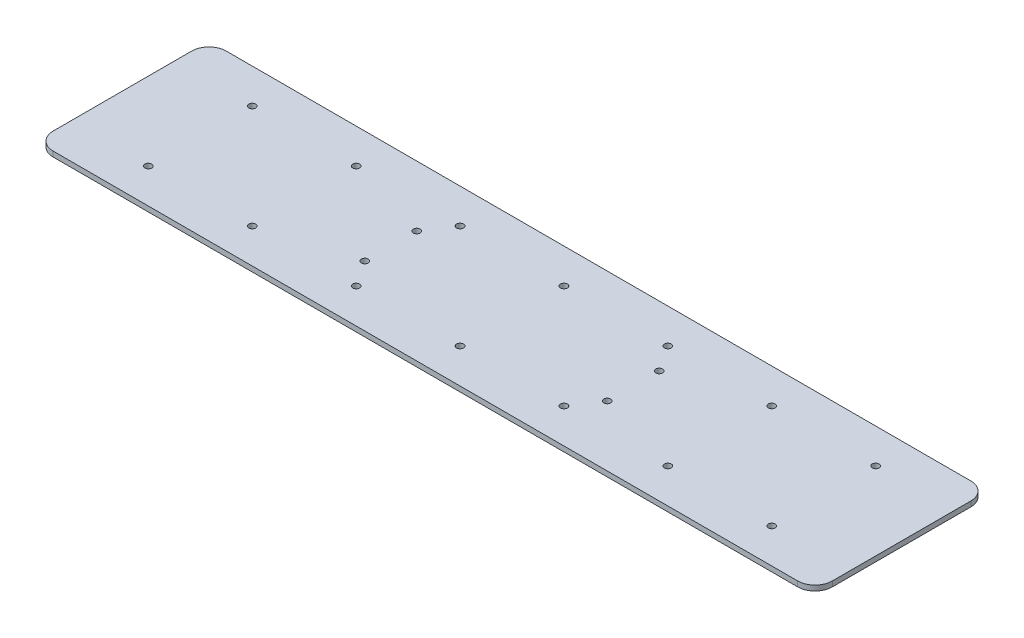
from build123d import *

# Parameters (mm, degrees)
EXTRUDE_1_DEPTH     = 3
SKETCH_2_R          = 2
CUT_EXTRUDE_1_DEPTH = 231.508134347
SKETCH_3_R          = 2
CUT_EXTRUDE_2_DEPTH = 231.508134347
SKETCH_4_R          = 2
CUT_EXTRUDE_3_DEPTH = 231.508134347


with BuildPart() as part:
    # 草图1 → 凸台-拉伸1 (new body)
    with BuildSketch(Plane(origin=(0, 0, 0), x_dir=(1, 0, 0), z_dir=(0, 1, 0))):
        with BuildLine():
            Line((-215, 50), (215, 50))
            ThreePointArc((215, 50), (222.071067812, 47.071067812), (225, 40))
            Line((225, 40), (225, -40))
            ThreePointArc((225, -40), (222.071067812, -47.071067812), (215, -50))
            Line((215, -50), (-215, -50))
            ThreePointArc((-215, -50), (-222.071067812, -47.071067812), (-225, -40))
            Line((-225, -40), (-225, 40))
            ThreePointArc((-225, 40), (-222.071067812, 47.071067812), (-215, 50))
        make_face()
    extrude(amount=EXTRUDE_1_DEPTH)

    # 草图2 → 切除-拉伸1 (cut, through all)
    with BuildSketch(Plane(origin=(0, 3, 0), x_dir=(1, 0, 0), z_dir=(0, 1, 0))):
        with Locations(Location((-180, -30, 0), (0, 0, 270))):
            Circle(SKETCH_2_R)
        with Locations(Location((-120, -30, 0), (0, 0, 270))):
            Circle(SKETCH_2_R)
        with Locations(Location((-60, -30, 0), (0, 0, 270))):
            Circle(SKETCH_2_R)
        with Locations(Location((0, -30, 0), (0, 0, 270))):
            Circle(SKETCH_2_R)
        with Locations(Location((60, -30, 0), (0, 0, 270))):
            Circle(SKETCH_2_R)
        with Locations(Location((120, -30, 0), (0, 0, 270))):
            Circle(SKETCH_2_R)
        with Locations(Location((180, -30, 0), (0, 0, 270))):
            Circle(SKETCH_2_R)
    extrude(amount=-CUT_EXTRUDE_1_DEPTH, mode=Mode.SUBTRACT)

    # 草图3 → 切除-拉伸2 (cut, through all)
    with BuildSketch(Plane(origin=(0, 3, 0), x_dir=(1, 0, 0), z_dir=(0, 1, 0))):
        with Locations(Location((-180, 30, 0), (0, 0, 270))):
            Circle(SKETCH_3_R)
        with Locations(Location((-120, 30, 0), (0, 0, 270))):
            Circle(SKETCH_3_R)
        with Locations(Location((-60, 30, 0), (0, 0, 270))):
            Circle(SKETCH_3_R)
        with Locations(Location((0, 30, 0), (0, 0, 270))):
            Circle(SKETCH_3_R)
        with Locations(Location((60, 30, 0), (0, 0, 270))):
            Circle(SKETCH_3_R)
        with Locations(Location((120, 30, 0), (0, 0, 270))):
            Circle(SKETCH_3_R)
        with Locations(Location((180, 30, 0), (0, 0, 270))):
            Circle(SKETCH_3_R)
    extrude(amount=-CUT_EXTRUDE_2_DEPTH, mode=Mode.SUBTRACT)

    # 草图4 → 切除-拉伸3 (cut, through all)
    with BuildSketch(Plane(origin=(0, 3, 0), x_dir=(1, 0, 0), z_dir=(0, 1, 0))):
        with Locations(Location((-70, 15, 0), (0, 0, 270))):
            Circle(SKETCH_4_R)
        with Locations(Location((70, 15, 0), (0, 0, 270))):
            Circle(SKETCH_4_R)
        with Locations(Location((-70, -15, 0), (0, 0, 270))):
            Circle(SKETCH_4_R)
        with Locations(Location((70, -15, 0), (0, 0, 270))):
            Circle(SKETCH_4_R)
    extrude(amount=-CUT_EXTRUDE_3_DEPTH, mode=Mode.SUBTRACT)


solid = part.part
